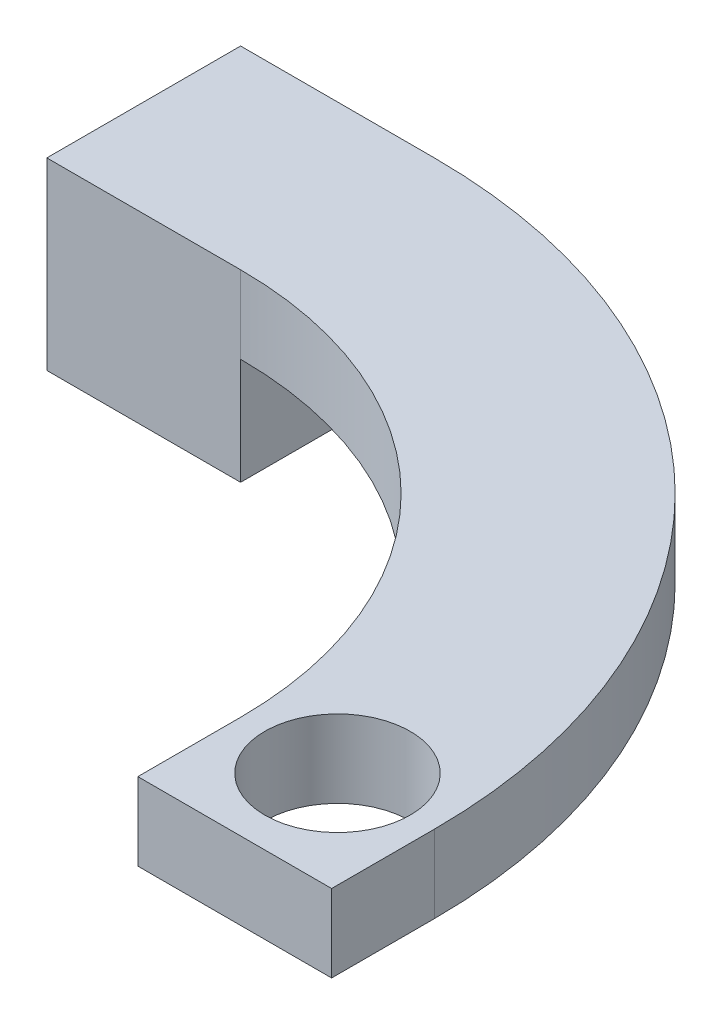
from build123d import *

# Parameters (mm, degrees)
SKETCH1_R               = 7.5
BOSS_EXTRUDE1_DEPTH     = 8
CROQUIS6_W              = 20
CROQUIS6_H              = 20
SALIENTE_EXTRUIR5_DEPTH = 11
CROQUIS7_R              = 1.5
CORTAR_EXTRUIR1_DEPTH   = 10


with BuildPart() as part:
    # Sketch1 → Boss-Extrude1 (new body)
    with BuildSketch(Plane(origin=(0, 0, 0), x_dir=(1, 0, 0), z_dir=(0, 1, 0))):
        with BuildLine():
            Line((50.606601718, 10.606601718), (50.606601718, 0))
            Line((50.606601718, 0), (70.606601718, 0))
            Line((70.606601718, 0), (70.606601718, 10.606601718))
            ThreePointArc((70.606601718, 10.606601718), (53.033008589, 53.033008589), (10.606601718, 70.606601718))
            Line((10.606601718, 70.606601718), (-9.393398282, 70.606601718))
            Line((-9.393398282, 70.606601718), (-9.393398282, 50.606601718))
            Line((-9.393398282, 50.606601718), (10.606601718, 50.606601718))
            ThreePointArc((10.606601718, 50.606601718), (38.890872965, 38.890872965), (50.606601718, 10.606601718))
        make_face()
        with Locations(Location((60.606601718, 10.606601718, 0), (0, 0, 270))):
            Circle(SKETCH1_R, mode=Mode.SUBTRACT)
    extrude(amount=BOSS_EXTRUDE1_DEPTH)

    # Croquis6 → Saliente-Extruir5 (add)
    with BuildSketch(Plane.XZ):
        with Locations((0.606601718, -60.606601718)):
            Rectangle(CROQUIS6_W, CROQUIS6_H)
    extrude(amount=SALIENTE_EXTRUIR5_DEPTH)

    # Croquis7 → Cortar-Extruir1 (cut)
    with BuildSketch(Plane.XZ.offset(11)):
        with Locations(Location((-5.393398282, -60.606601718, 0), (0, 0, 270))):
            Circle(CROQUIS7_R)
        with Locations(Location((6.606601718, -60.606601718, 0), (0, 0, 90))):
            Circle(CROQUIS7_R)
        with Locations(Location((0.606601718, -66.606601718, 0), (0, 0, 270))):
            Circle(CROQUIS7_R)
        with Locations(Location((0.606601718, -54.606601718, 0), (0, 0, 90))):
            Circle(CROQUIS7_R)
    extrude(amount=-CORTAR_EXTRUIR1_DEPTH, mode=Mode.SUBTRACT)


solid = part.part
